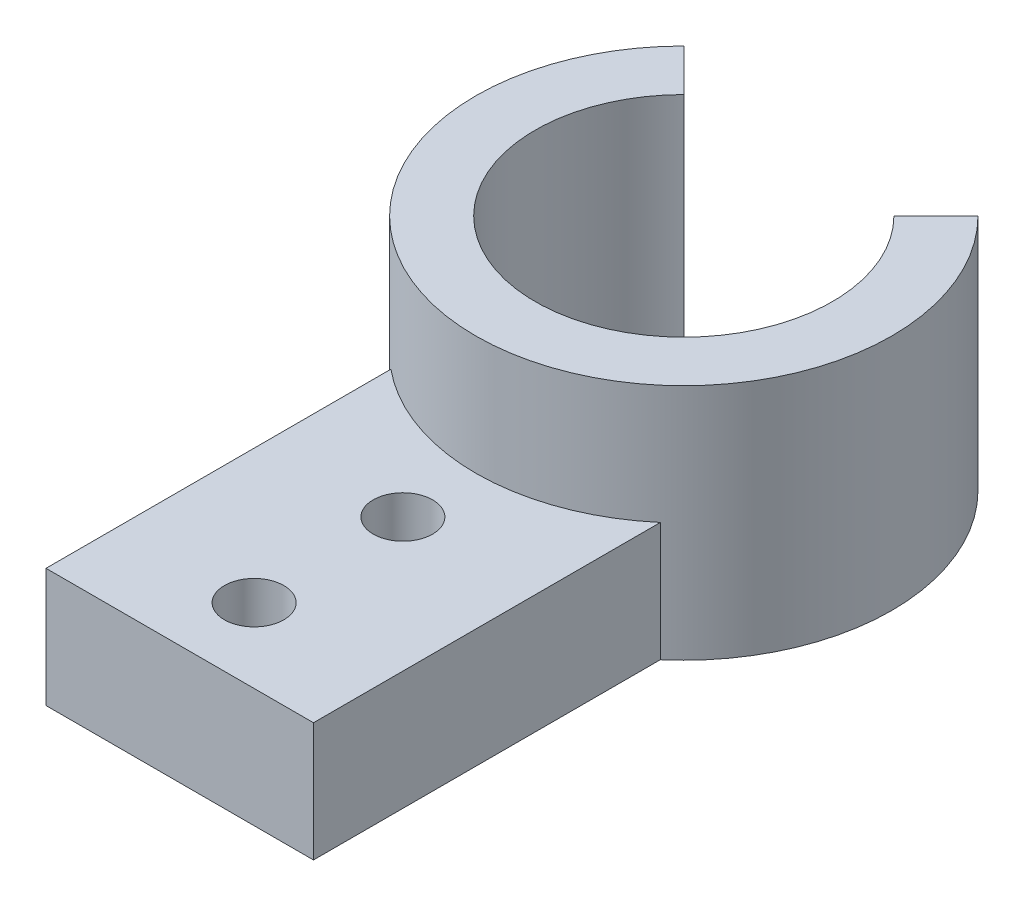
from build123d import *

# Parameters (mm, degrees)
SKETCH1_R                = 7
SKETCH1_R_2              = 5
BOSS_EXTRUDE1_DEPTH      = 8
CUT_EXTRUDE1_DEPTH       = 8
SKETCH5_W                = 9
SKETCH5_H                = 10
BOSS_EXTRUDE2_DEPTH      = 4
BOSS_EXTRUDE4_REACH      = 17.994
BOSS_EXTRUDE4_END_RADIUS = 7
SKETCH6_W                = 9
SKETCH6_H                = 4
SKETCH8_R                = 1
CUT_EXTRUDE2_DEPTH       = 8


with BuildPart() as part:
    # Sketch1 → Boss-Extrude1 (new body)
    with BuildSketch(Plane(origin=(0, 0, 0), x_dir=(1, 0, 0), z_dir=(0, 1, 0))):
        with Locations(Location((0, 0, 0), (0, 0, 270))):
            Circle(SKETCH1_R)
        with Locations(Location((0, 0, 0), (0, 0, 270))):
            Circle(SKETCH1_R_2, mode=Mode.SUBTRACT)
    extrude(amount=BOSS_EXTRUDE1_DEPTH)

    # Sketch2 → Cut-Extrude1 (cut)
    with BuildSketch(Plane(origin=(0, 8, 0), x_dir=(1, 0, 0), z_dir=(0, 1, 0))):
        Polygon((0, 0), (-4.949747468, 4.949747468), (-8.526445785, 8.526445785), (8.526445785, 8.526445785), align=None)
    extrude(amount=-CUT_EXTRUDE1_DEPTH, mode=Mode.SUBTRACT)



with BuildPart() as body_2:
    # Sketch5 → Boss-Extrude2 (new body)
    with BuildSketch(Plane(origin=(0, 0, 0), x_dir=(1, 0, 0), z_dir=(0, 1, 0))):
        with Locations((0.039670369, -12)):
            Rectangle(SKETCH5_W, SKETCH5_H)
    extrude(amount=BOSS_EXTRUDE2_DEPTH)


with BuildPart() as part_1:
    add(part.part)

    add(body_2.part)  # Boss-Extrude4 merges body 2
    # Boss-Extrude4: up to this cylinder (the profile starts outside it)
    boss_extrude4_end = Plane(origin=(0, 2, 0), z_dir=(0, -1, 0)) * Cylinder(BOSS_EXTRUDE4_END_RADIUS, 50.988, mode=Mode.PRIVATE)
    # Sketch6 → Boss-Extrude4 (add, up to the surface)
    with BuildSketch(Plane(origin=(0, 0, 7), x_dir=(-1, 0, 0), z_dir=(0, 0, -1)), mode=Mode.PRIVATE) as boss_extrude4_sk1:
        with Locations((-0.039670369, 2)):
            Rectangle(SKETCH6_W, SKETCH6_H)
    boss_extrude4_tool1 = extrude(boss_extrude4_sk1.sketch, amount=BOSS_EXTRUDE4_REACH, mode=Mode.PRIVATE) - boss_extrude4_end
    add(boss_extrude4_tool1.solids().sort_by_distance((0.03967, 2, 7))[0])
    add(boss_extrude4_tool1.solids().sort_by_distance((0.03967, 2, 7))[1])

    # Sketch8 → Cut-Extrude2 (cut)
    with BuildSketch(Plane(origin=(0, 4, 0), x_dir=(1, 0, 0), z_dir=(0, 1, 0))):
        with Locations(Location((0.048760734, -9.499904202, 0), (0, 0, 270))):
            Circle(SKETCH8_R)
        with Locations(Location((0.042700568, -14.499904202, 0), (0, 0, 270))):
            Circle(SKETCH8_R)
    extrude(amount=-CUT_EXTRUDE2_DEPTH, mode=Mode.SUBTRACT)


solid = part_1.part
